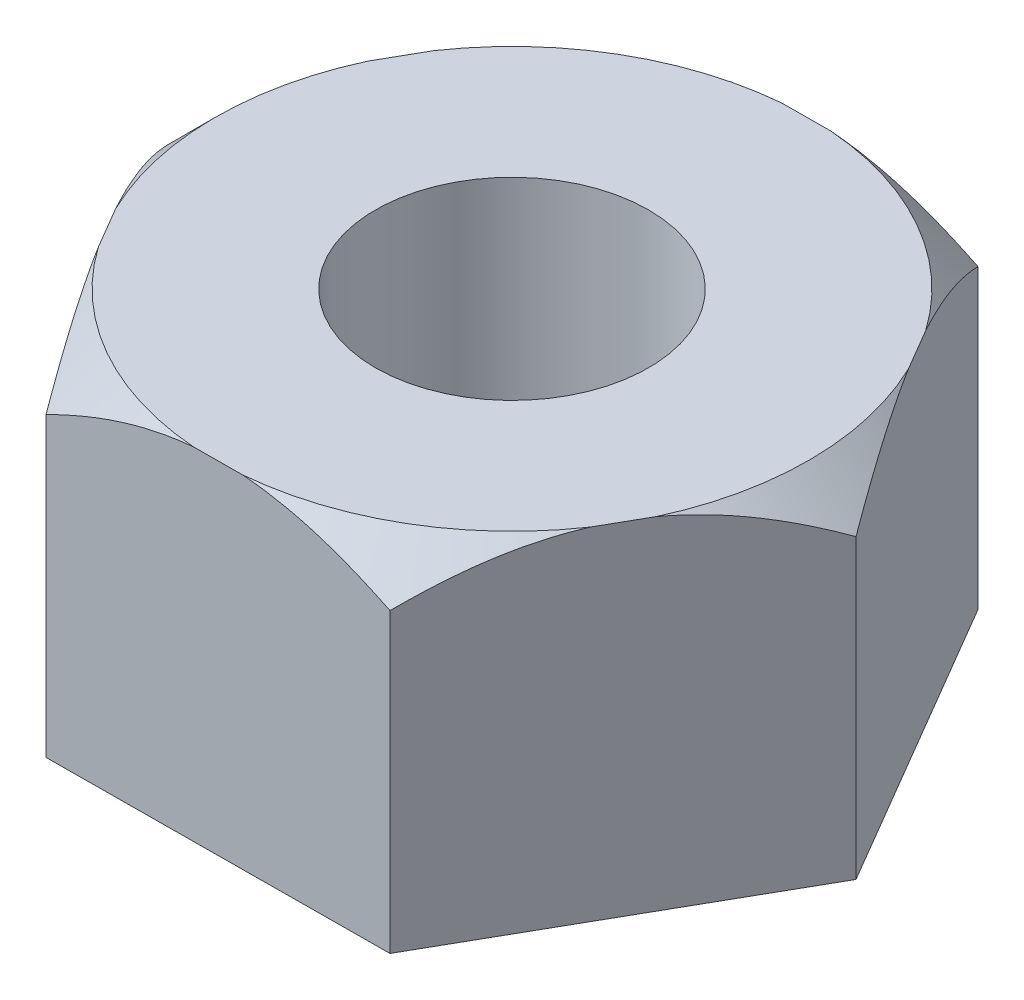
from build123d import *

# Parameters (mm, degrees)
SKETCH1_R           = 2
BOSS_EXTRUDE1_DEPTH = 5
SKETCH2_OUTSIDE_W   = 24.832
SKETCH2_OUTSIDE_H   = 23.526
SKETCH2_OUTSIDE_R   = 4.344639207
CUT_EXTRUDE1_DEPTH  = 5
CUT_EXTRUDE1_DRAFT  = -45


with BuildPart() as part:
    # Sketch1 → Boss-Extrude1 (new body)
    with BuildSketch(Plane(origin=(0, 0, 0), x_dir=(1, 0, 0), z_dir=(0, 1, 0))):
        Polygon((2.528652856, -4.313584285), (5, 0.033085469), (2.471347144, 4.346669753), (-2.528652856, 4.313584285), (-5, -0.033085469), (-2.471347144, -4.346669753), align=None)
        with Locations(Location((0, 0, 0), (0, 0, 270))):
            Circle(SKETCH1_R, mode=Mode.SUBTRACT)
    extrude(amount=BOSS_EXTRUDE1_DEPTH)


with BuildPart() as cut_extrude1_tool:
    # Sketch2 outside → Cut-Extrude1 (with draft: the straight prism first)
    with BuildSketch(Plane(origin=(0, 5, 0), x_dir=(1, 0, 0), z_dir=(0, 1, 0))):
        Rectangle(SKETCH2_OUTSIDE_W, SKETCH2_OUTSIDE_H)
        Circle(SKETCH2_OUTSIDE_R, mode=Mode.SUBTRACT)
    extrude(amount=-CUT_EXTRUDE1_DEPTH)
    # Cut-Extrude1: the draft: its side faces are tilted about the plane it starts from
    cut_extrude1_sides = [cut_extrude1_tool.faces().sort_by_distance(p)[0] for p in [
        (0, 2.5, 11.763),
        (12.416, 2.5, 0),
        (0, 2.5, -11.763),
        (-12.416, 2.5, 0),
        (-4.344639207, 2.5, 0),
    ]]
    draft(cut_extrude1_sides, Plane(origin=(0, 5, 0), x_dir=(1, 0, 0), z_dir=(0, 1, 0)), CUT_EXTRUDE1_DRAFT)


with BuildPart() as part_1:
    add(part.part)

    # Cut-Extrude1: cut by cut_extrude1_tool
    add(cut_extrude1_tool.part, mode=Mode.SUBTRACT)


solid = part_1.part
